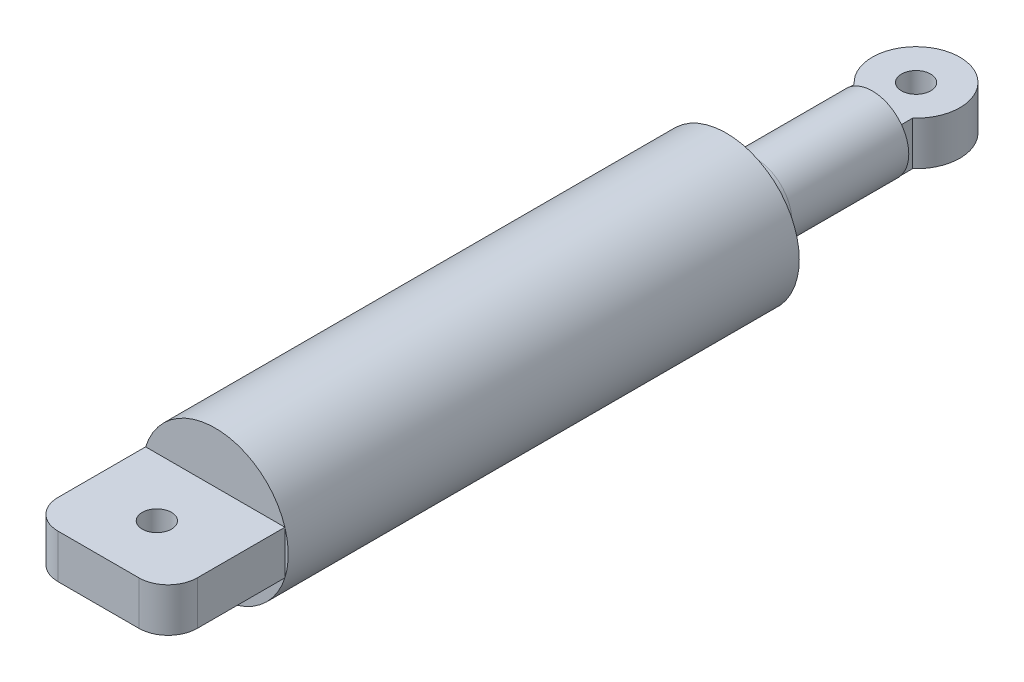
from build123d import *

# Parameters (mm, degrees)
SKETCH1_R           = 5
BOSS_EXTRUDE1_DEPTH = 35
SKETCH2_W           = 9.539392014
SKETCH2_H           = 3
BOSS_EXTRUDE2_DEPTH = 8
SKETCH3_R           = 2.5
BOSS_EXTRUDE3_DEPTH = 10
SKETCH4_W           = 4
SKETCH4_H           = 3
BOSS_EXTRUDE4_DEPTH = 3
SKETCH5_R           = 3
BOSS_EXTRUDE5_DEPTH = 3
FILLET1_R           = 2
FILLET4_R           = 2
SKETCH6_R           = 1
CUT_EXTRUDE1_DEPTH  = 44.774992861
SKETCH7_R           = 1
CUT_EXTRUDE2_DEPTH  = 44.774992861


with BuildPart() as part:
    # Sketch1 → Boss-Extrude1 (new body)
    with BuildSketch(Plane.XY):
        Circle(SKETCH1_R)
    extrude(amount=BOSS_EXTRUDE1_DEPTH)

    # Sketch2 → Boss-Extrude2 (add)
    with BuildSketch(Plane.XY.offset(35)):
        Rectangle(SKETCH2_W, SKETCH2_H)
    extrude(amount=BOSS_EXTRUDE2_DEPTH)

    # Sketch3 → Boss-Extrude3 (add)
    with BuildSketch(Plane(origin=(0, 0, 0), x_dir=(-1, 0, 0), z_dir=(0, 0, -1))):
        Circle(SKETCH3_R)
    extrude(amount=BOSS_EXTRUDE3_DEPTH)

    # Sketch4 → Boss-Extrude4 (add)
    with BuildSketch(Plane(origin=(0, 0, -10), x_dir=(-1, 0, 0), z_dir=(0, 0, -1))):
        Rectangle(SKETCH4_W, SKETCH4_H)
    extrude(amount=BOSS_EXTRUDE4_DEPTH)

    # Sketch5 → Boss-Extrude5 (add)
    with BuildSketch(Plane(origin=(0, -1.5, 0), x_dir=(-1, 0, 0), z_dir=(0, -1, 0))):
        with Locations((0, 13)):
            Circle(SKETCH5_R)
    extrude(amount=-BOSS_EXTRUDE5_DEPTH)

    # Fillet1
    fillet1_edges = [part.edges().sort_by_distance(p)[0] for p in [
        (4.769696007, 0, 43),
        (-4.769696007, 0, 43),
    ]]
    fillet(fillet1_edges, radius=FILLET1_R)

    # Fillet4
    fillet4_edges = [part.edges().sort_by_distance(p)[0] for p in [
        (2.5, 0, 0),
    ]]
    fillet(fillet4_edges, radius=FILLET4_R)

    # Sketch6 → Cut-Extrude1 (cut, through all)
    with BuildSketch(Plane(origin=(0, 1.5, 0), x_dir=(1, 0, 0), z_dir=(0, 1, 0))):
        with Locations(Location((0, 13, 0), (0, 0, 270))):
            Circle(SKETCH6_R)
    extrude(amount=-CUT_EXTRUDE1_DEPTH, mode=Mode.SUBTRACT)

    # Sketch7 → Cut-Extrude2 (cut, through all)
    with BuildSketch(Plane(origin=(0, 1.5, 0), x_dir=(1, 0, 0), z_dir=(0, 1, 0))):
        with Locations(Location((0, -39, 0), (0, 0, 270))):
            Circle(SKETCH7_R)
    extrude(amount=-CUT_EXTRUDE2_DEPTH, mode=Mode.SUBTRACT)


solid = part.part
